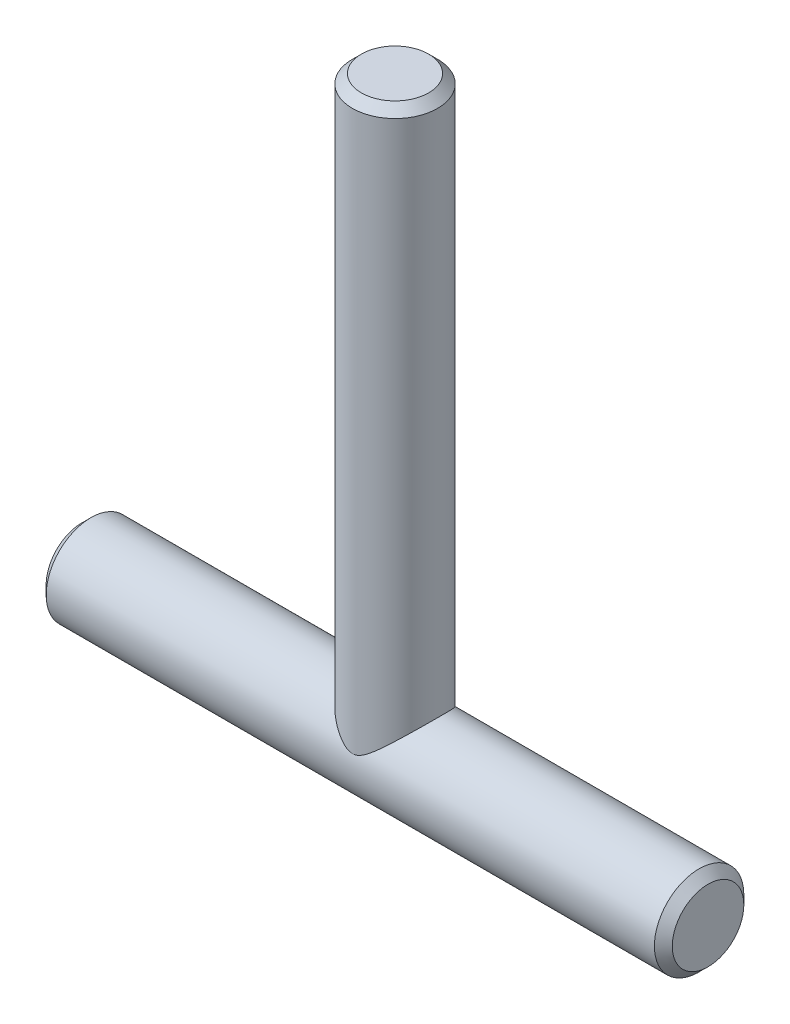
from build123d import *

# Parameters (mm, degrees)
SKETCH1_R                = 5
BOSS_EXTRUDE1_DEPTH      = 35
BOSS_EXTRUDE5_DEPTH      = 60
BOSS_EXTRUDE5_DEPTH_BACK = 5
SKETCH2_R                = 4.7625
CHAMFER1_SIZE            = 1


with BuildPart() as part:
    # Sketch1 → Boss-Extrude1 (new, symmetric)
    with BuildSketch(Plane(origin=(0, 0, 0), x_dir=(0, 0, -1), z_dir=(1, 0, 0))):
        with Locations((0, -5)):
            Circle(SKETCH1_R)
    extrude(amount=BOSS_EXTRUDE1_DEPTH, both=True)

    # Sketch2 → Boss-Extrude5 (add, two sides: drawn at the far end of the back side and taken through both)
    with BuildSketch(Plane(origin=(0, 0, 0), x_dir=(1, 0, 0), z_dir=(0, 1, 0)).offset(-BOSS_EXTRUDE5_DEPTH_BACK)):
        with Locations(Location((0, 0, 0), (0, 0, 270))):
            Circle(SKETCH2_R)
    extrude(amount=BOSS_EXTRUDE5_DEPTH + BOSS_EXTRUDE5_DEPTH_BACK)

    # Chamfer1
    chamfer1_edges = [part.edges().sort_by_distance(p)[0] for p in [
        (-35, -5, 5),
        (35, -5, 5),
        (0, 60, -4.7625),
    ]]
    chamfer(chamfer1_edges, length=CHAMFER1_SIZE)


solid = part.part
